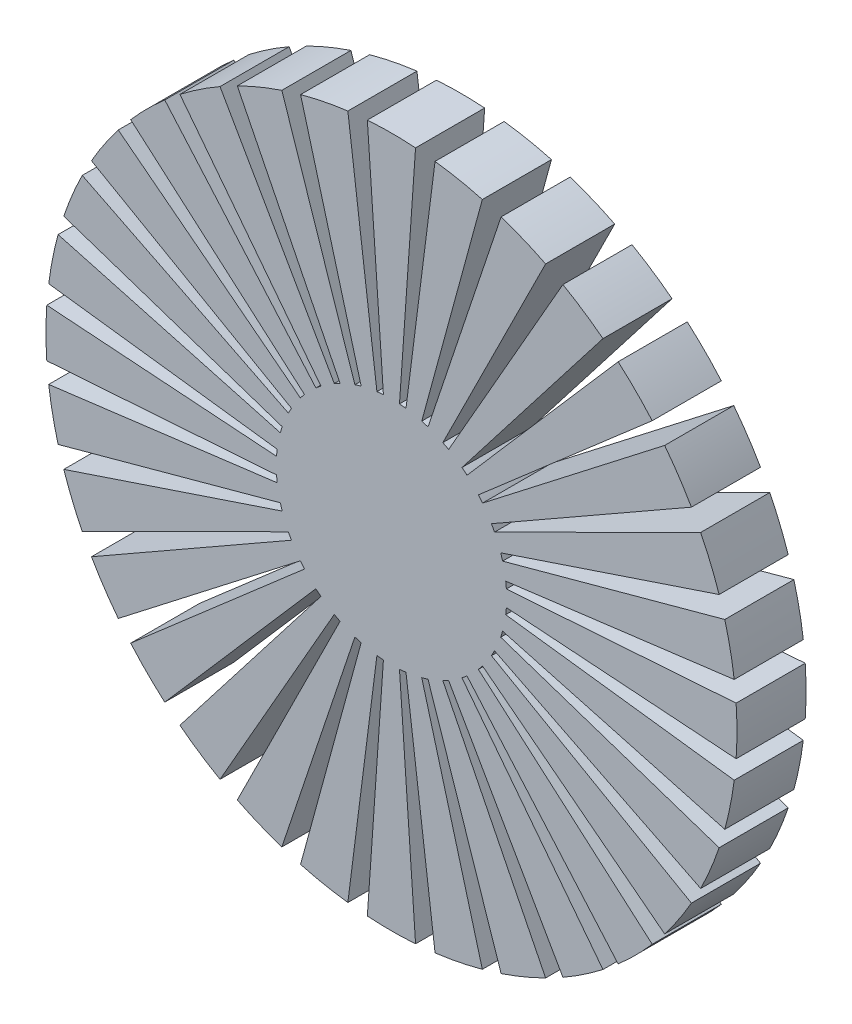
from build123d import *

# Parameters (mm, degrees)
BOSS_EXTRUDE1_DEPTH = 30


with BuildPart() as part:
    # Sketch1 → Boss-Extrude1 (new body)
    with BuildSketch(Plane.XY):
        with BuildLine():
            Line((-3.487823687, 49.878202513), (-10.463471062, 149.634607539))
            ThreePointArc((-10.463471062, 149.634607539), (0, 150), (10.463471062, 149.634607539))
            Line((10.463471062, 149.634607539), (3.487823687, 49.878202513))
            ThreePointArc((3.487823687, 49.878202513), (4.900857016, 49.759236334), (6.309948457, 49.600247484))
            Line((6.309948457, 49.600247484), (18.92984537, 148.800742452))
            ThreePointArc((18.92984537, 148.800742452), (29.263548302, 147.11779206), (39.454682169, 144.718098574))
            Line((39.454682169, 144.718098574), (13.151560723, 48.239366191))
            ThreePointArc((13.151560723, 48.239366191), (14.514233863, 47.847016787), (15.86523282, 47.41618276))
            Line((15.86523282, 47.41618276), (47.595698461, 142.248548281))
            ThreePointArc((47.595698461, 142.248548281), (57.402514855, 138.581929877), (66.929671966, 134.24015424))
            Line((66.929671966, 134.24015424), (22.309890655, 44.74671808))
            ThreePointArc((22.309890655, 44.74671808), (23.569836841, 44.096063217), (24.810825184, 43.409940724))
            Line((24.810825184, 43.409940724), (74.432475551, 130.229822173))
            ThreePointArc((74.432475551, 130.229822173), (83.335534953, 124.720441845), (91.832592005, 118.603436062))
            Line((91.832592005, 118.603436062), (30.610864002, 39.534478687))
            ThreePointArc((30.610864002, 39.534478687), (31.719664208, 38.650522668), (32.80295145, 37.735479011))
            Line((32.80295145, 37.735479011), (98.408854349, 113.206437033))
            ThreePointArc((98.408854349, 113.206437033), (106.066017178, 106.066017178), (113.206437033, 98.408854349))
            Line((113.206437033, 98.408854349), (37.735479011, 32.80295145))
            ThreePointArc((37.735479011, 32.80295145), (38.650522668, 31.719664208), (39.534478687, 30.610864002))
            Line((39.534478687, 30.610864002), (118.603436062, 91.832592005))
            ThreePointArc((118.603436062, 91.832592005), (124.720441845, 83.335534953), (130.229822173, 74.432475551))
            Line((130.229822173, 74.432475551), (43.409940724, 24.810825184))
            ThreePointArc((43.409940724, 24.810825184), (44.096063217, 23.569836841), (44.74671808, 22.309890655))
            Line((44.74671808, 22.309890655), (134.24015424, 66.929671966))
            ThreePointArc((134.24015424, 66.929671966), (138.581929877, 57.402514855), (142.248548281, 47.595698461))
            Line((142.248548281, 47.595698461), (47.41618276, 15.86523282))
            ThreePointArc((47.41618276, 15.86523282), (47.847016787, 14.514233863), (48.239366191, 13.151560723))
            Line((48.239366191, 13.151560723), (144.718098574, 39.454682169))
            ThreePointArc((144.718098574, 39.454682169), (147.11779206, 29.263548302), (148.800742452, 18.92984537))
            Line((148.800742452, 18.92984537), (49.600247484, 6.309948457))
            ThreePointArc((49.600247484, 6.309948457), (49.759236334, 4.900857016), (49.878202513, 3.487823687))
            Line((49.878202513, 3.487823687), (149.634607539, 10.463471062))
            ThreePointArc((149.634607539, 10.463471062), (150, 0), (149.634607539, -10.463471062))
            Line((149.634607539, -10.463471062), (49.878202513, -3.487823687))
            ThreePointArc((49.878202513, -3.487823687), (49.759236334, -4.900857016), (49.600247484, -6.309948457))
            Line((49.600247484, -6.309948457), (148.800742452, -18.92984537))
            ThreePointArc((148.800742452, -18.92984537), (147.11779206, -29.263548302), (144.718098574, -39.454682169))
            Line((144.718098574, -39.454682169), (48.239366191, -13.151560723))
            ThreePointArc((48.239366191, -13.151560723), (47.847016787, -14.514233863), (47.41618276, -15.86523282))
            Line((47.41618276, -15.86523282), (142.248548281, -47.595698461))
            ThreePointArc((142.248548281, -47.595698461), (138.581929877, -57.402514855), (134.24015424, -66.929671966))
            Line((134.24015424, -66.929671966), (44.74671808, -22.309890655))
            ThreePointArc((44.74671808, -22.309890655), (44.096063217, -23.569836841), (43.409940724, -24.810825184))
            Line((43.409940724, -24.810825184), (130.229822173, -74.432475551))
            ThreePointArc((130.229822173, -74.432475551), (124.720441845, -83.335534953), (118.603436062, -91.832592005))
            Line((118.603436062, -91.832592005), (39.534478687, -30.610864002))
            ThreePointArc((39.534478687, -30.610864002), (38.650522668, -31.719664208), (37.735479011, -32.80295145))
            Line((37.735479011, -32.80295145), (113.206437033, -98.408854349))
            ThreePointArc((113.206437033, -98.408854349), (106.066017178, -106.066017178), (98.408854349, -113.206437033))
            Line((98.408854349, -113.206437033), (32.80295145, -37.735479011))
            ThreePointArc((32.80295145, -37.735479011), (31.719664208, -38.650522668), (30.610864002, -39.534478687))
            Line((30.610864002, -39.534478687), (91.832592005, -118.603436062))
            ThreePointArc((91.832592005, -118.603436062), (83.335534953, -124.720441845), (74.432475551, -130.229822173))
            Line((74.432475551, -130.229822173), (24.810825184, -43.409940724))
            ThreePointArc((24.810825184, -43.409940724), (23.569836841, -44.096063217), (22.309890655, -44.74671808))
            Line((22.309890655, -44.74671808), (66.929671966, -134.24015424))
            ThreePointArc((66.929671966, -134.24015424), (57.402514855, -138.581929877), (47.595698461, -142.248548281))
            Line((47.595698461, -142.248548281), (15.86523282, -47.41618276))
            ThreePointArc((15.86523282, -47.41618276), (14.514233863, -47.847016787), (13.151560723, -48.239366191))
            Line((13.151560723, -48.239366191), (39.454682169, -144.718098574))
            ThreePointArc((39.454682169, -144.718098574), (29.263548302, -147.11779206), (18.92984537, -148.800742452))
            Line((18.92984537, -148.800742452), (6.309948457, -49.600247484))
            ThreePointArc((6.309948457, -49.600247484), (4.900857016, -49.759236334), (3.487823687, -49.878202513))
            Line((3.487823687, -49.878202513), (10.463471062, -149.634607539))
            ThreePointArc((10.463471062, -149.634607539), (0, -150), (-10.463471062, -149.634607539))
            Line((-10.463471062, -149.634607539), (-3.487823687, -49.878202513))
            ThreePointArc((-3.487823687, -49.878202513), (-4.900857016, -49.759236334), (-6.309948457, -49.600247484))
            Line((-6.309948457, -49.600247484), (-18.92984537, -148.800742452))
            ThreePointArc((-18.92984537, -148.800742452), (-29.263548302, -147.11779206), (-39.454682169, -144.718098574))
            Line((-39.454682169, -144.718098574), (-13.151560723, -48.239366191))
            ThreePointArc((-13.151560723, -48.239366191), (-14.514233863, -47.847016787), (-15.86523282, -47.41618276))
            Line((-15.86523282, -47.41618276), (-47.595698461, -142.248548281))
            ThreePointArc((-47.595698461, -142.248548281), (-57.402514855, -138.581929877), (-66.929671966, -134.24015424))
            Line((-66.929671966, -134.24015424), (-22.309890655, -44.74671808))
            ThreePointArc((-22.309890655, -44.74671808), (-23.569836841, -44.096063217), (-24.810825184, -43.409940724))
            Line((-24.810825184, -43.409940724), (-74.432475551, -130.229822173))
            ThreePointArc((-74.432475551, -130.229822173), (-83.335534953, -124.720441845), (-91.832592005, -118.603436062))
            Line((-91.832592005, -118.603436062), (-30.610864002, -39.534478687))
            ThreePointArc((-30.610864002, -39.534478687), (-31.719664208, -38.650522668), (-32.80295145, -37.735479011))
            Line((-32.80295145, -37.735479011), (-98.408854349, -113.206437033))
            ThreePointArc((-98.408854349, -113.206437033), (-106.066017178, -106.066017178), (-113.206437033, -98.408854349))
            Line((-113.206437033, -98.408854349), (-37.735479011, -32.80295145))
            ThreePointArc((-37.735479011, -32.80295145), (-38.650522668, -31.719664208), (-39.534478687, -30.610864002))
            Line((-39.534478687, -30.610864002), (-118.603436062, -91.832592005))
            ThreePointArc((-118.603436062, -91.832592005), (-124.720441845, -83.335534953), (-130.229822173, -74.432475551))
            Line((-130.229822173, -74.432475551), (-43.409940724, -24.810825184))
            ThreePointArc((-43.409940724, -24.810825184), (-44.096063217, -23.569836841), (-44.74671808, -22.309890655))
            Line((-44.74671808, -22.309890655), (-134.24015424, -66.929671966))
            ThreePointArc((-134.24015424, -66.929671966), (-138.581929877, -57.402514855), (-142.248548281, -47.595698461))
            Line((-142.248548281, -47.595698461), (-47.41618276, -15.86523282))
            ThreePointArc((-47.41618276, -15.86523282), (-47.847016787, -14.514233863), (-48.239366191, -13.151560723))
            Line((-48.239366191, -13.151560723), (-144.718098574, -39.454682169))
            ThreePointArc((-144.718098574, -39.454682169), (-147.11779206, -29.263548302), (-148.800742452, -18.92984537))
            Line((-148.800742452, -18.92984537), (-49.600247484, -6.309948457))
            ThreePointArc((-49.600247484, -6.309948457), (-49.759236334, -4.900857016), (-49.878202513, -3.487823687))
            Line((-49.878202513, -3.487823687), (-149.634607539, -10.463471062))
            ThreePointArc((-149.634607539, -10.463471062), (-150, 0), (-149.634607539, 10.463471062))
            Line((-149.634607539, 10.463471062), (-49.878202513, 3.487823687))
            ThreePointArc((-49.878202513, 3.487823687), (-49.759236334, 4.900857016), (-49.600247484, 6.309948457))
            Line((-49.600247484, 6.309948457), (-148.800742452, 18.92984537))
            ThreePointArc((-148.800742452, 18.92984537), (-147.11779206, 29.263548302), (-144.718098574, 39.454682169))
            Line((-144.718098574, 39.454682169), (-48.239366191, 13.151560723))
            ThreePointArc((-48.239366191, 13.151560723), (-47.847016787, 14.514233863), (-47.41618276, 15.86523282))
            Line((-47.41618276, 15.86523282), (-142.248548281, 47.595698461))
            ThreePointArc((-142.248548281, 47.595698461), (-138.581929877, 57.402514855), (-134.24015424, 66.929671966))
            Line((-134.24015424, 66.929671966), (-44.74671808, 22.309890655))
            ThreePointArc((-44.74671808, 22.309890655), (-44.096063217, 23.569836841), (-43.409940724, 24.810825184))
            Line((-43.409940724, 24.810825184), (-130.229822173, 74.432475551))
            ThreePointArc((-130.229822173, 74.432475551), (-124.720441845, 83.335534953), (-118.603436062, 91.832592005))
            Line((-118.603436062, 91.832592005), (-39.534478687, 30.610864002))
            ThreePointArc((-39.534478687, 30.610864002), (-38.650522668, 31.719664208), (-37.735479011, 32.80295145))
            Line((-37.735479011, 32.80295145), (-113.206437033, 98.408854349))
            ThreePointArc((-113.206437033, 98.408854349), (-106.066017178, 106.066017178), (-98.408854349, 113.206437033))
            Line((-98.408854349, 113.206437033), (-32.80295145, 37.735479011))
            ThreePointArc((-32.80295145, 37.735479011), (-31.719664208, 38.650522668), (-30.610864002, 39.534478687))
            Line((-30.610864002, 39.534478687), (-91.832592005, 118.603436062))
            ThreePointArc((-91.832592005, 118.603436062), (-83.335534953, 124.720441845), (-74.432475551, 130.229822173))
            Line((-74.432475551, 130.229822173), (-24.810825184, 43.409940724))
            ThreePointArc((-24.810825184, 43.409940724), (-23.569836841, 44.096063217), (-22.309890655, 44.74671808))
            Line((-22.309890655, 44.74671808), (-66.929671966, 134.24015424))
            ThreePointArc((-66.929671966, 134.24015424), (-57.402514855, 138.581929877), (-47.595698461, 142.248548281))
            Line((-47.595698461, 142.248548281), (-15.86523282, 47.41618276))
            ThreePointArc((-15.86523282, 47.41618276), (-14.514233863, 47.847016787), (-13.151560723, 48.239366191))
            Line((-13.151560723, 48.239366191), (-39.454682169, 144.718098574))
            ThreePointArc((-39.454682169, 144.718098574), (-29.263548302, 147.11779206), (-18.92984537, 148.800742452))
            Line((-18.92984537, 148.800742452), (-6.309948457, 49.600247484))
            ThreePointArc((-6.309948457, 49.600247484), (-4.900857016, 49.759236334), (-3.487823687, 49.878202513))
        make_face()
    extrude(amount=BOSS_EXTRUDE1_DEPTH)


solid = part.part
